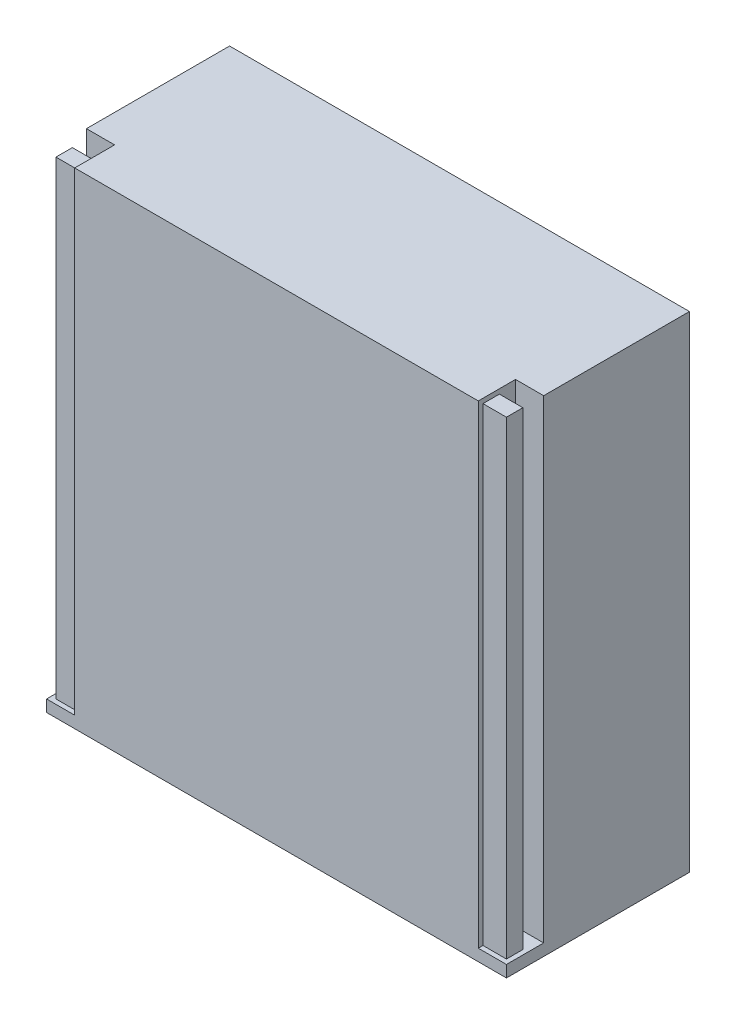
from build123d import *

# Parameters (mm, degrees)
CROQUIS1_W              = 196
CROQUIS1_H              = 78
SALIENTE_EXTRUIR1_DEPTH = 5
CROQUIS2_W              = 10
CROQUIS2_H              = 7
SALIENTE_EXTRUIR2_DEPTH = 200
SALIENTE_EXTRUIR3_DEPTH = 200
SALIENTE_EXTRUIR4_DEPTH = 2
CORTAR_EXTRUIR2_DEPTH   = 10


with BuildPart() as part:
    # Croquis1 → Saliente-Extruir1 (new body)
    with BuildSketch(Plane(origin=(0, 0, 0), x_dir=(1, 0, 0), z_dir=(0, 1, 0))):
        with Locations((-48.059642147, -1)):
            Rectangle(CROQUIS1_W, CROQUIS1_H)
    extrude(amount=SALIENTE_EXTRUIR1_DEPTH)

    # Croquis2 → Saliente-Extruir2 (add)
    with BuildSketch(Plane(origin=(0, 5, 0), x_dir=(1, 0, 0), z_dir=(0, 1, 0))):
        with Locations((-139.059642147, -34.5)):
            Rectangle(CROQUIS2_W, CROQUIS2_H)
        with Locations((42.940357853, -34.5)):
            Rectangle(CROQUIS2_W, CROQUIS2_H)
    extrude(amount=SALIENTE_EXTRUIR2_DEPTH)

    # Croquis4 → Saliente-Extruir3 (add)
    with BuildSketch(Plane(origin=(0, 5, 0), x_dir=(1, 0, 0), z_dir=(0, 1, 0))):
        Polygon((-146.059642147, -23), (-134.059642147, -23), (-134.059642147, -40), (37.940357853, -40), (37.940357853, -24.127895053), (49.940357853, -24.127895053), (49.940357853, 38), (47.940357853, 38), (47.940357853, -22.127895053), (35.940357853, -22.127895053), (35.940357853, -38), (-132.059642147, -38), (-132.059642147, -21.170903905), (-144.059642147, -21.170903905), (-144.059642147, 38), (-146.059642147, 38), align=None)
    extrude(amount=SALIENTE_EXTRUIR3_DEPTH)

    # Croquis5 → Saliente-Extruir4 (add)
    with BuildSketch(Plane(origin=(0, 205, 0), x_dir=(1, 0, 0), z_dir=(0, 1, 0))):
        Polygon((-146.059642147, 38), (49.940357853, 38), (49.940357853, -24.127895053), (37.940357853, -24.127895053), (37.940357853, -40), (-134.059642147, -40), (-134.059642147, -23), (-146.059642147, -23), align=None)
    extrude(amount=SALIENTE_EXTRUIR4_DEPTH)

    # Croquis6 → Cortar-Extruir2 (cut)
    with BuildSketch(Plane.XZ):
        with BuildLine():
            Line((-83.059642147, 9), (-13.059642147, 9))
            ThreePointArc((-13.059642147, 9), (-5.059642147, 1), (-13.059642147, -7))
            Line((-13.059642147, -7), (-83.059642147, -7))
            ThreePointArc((-83.059642147, -7), (-91.059642147, 1), (-83.059642147, 9))
        make_face()
    extrude(amount=-CORTAR_EXTRUIR2_DEPTH, mode=Mode.SUBTRACT)


solid = part.part
